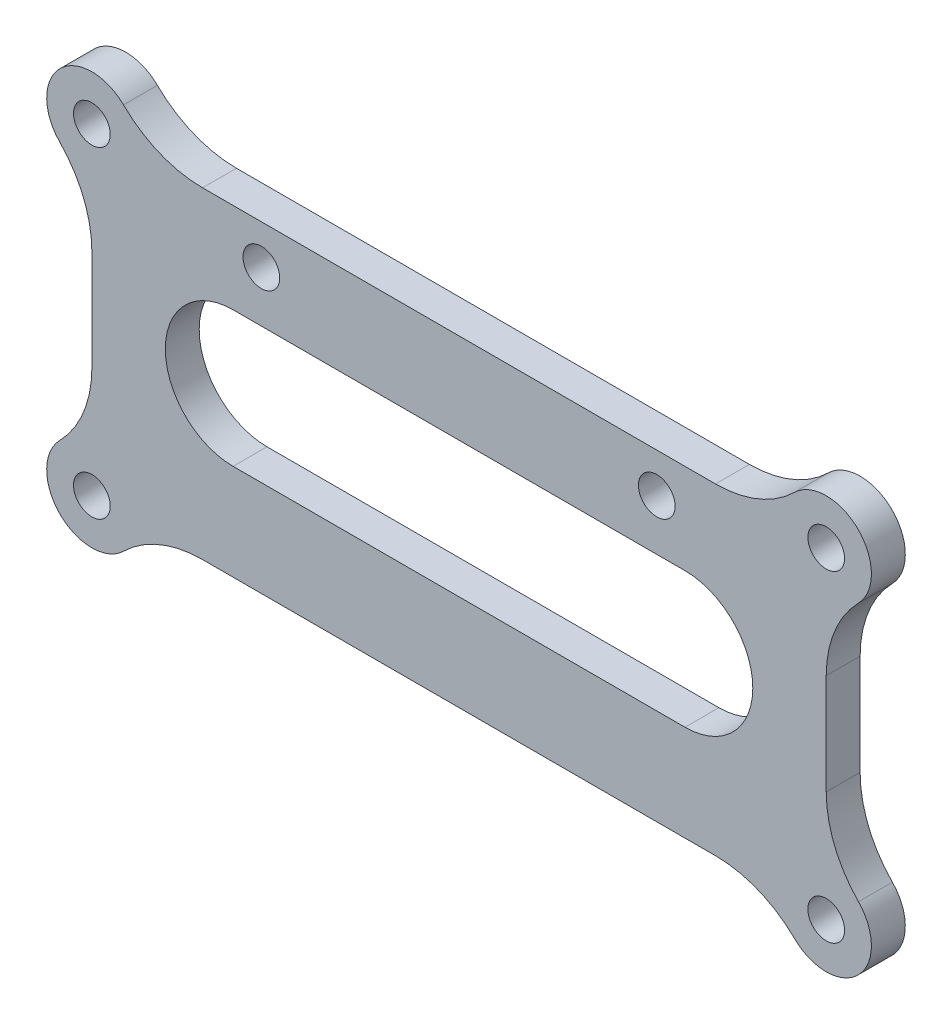
from build123d import *

# Parameters (mm, degrees)
SKETCH_1_R          = 1.625
EXTRUDE_1_DEPTH     = 3
FILLET_1_R          = 10
SKETCH_3_R          = 1.625
CUT_EXTRUDE_1_DEPTH = 10
CUT_EXTRUDE_4_DEPTH = 10


with BuildPart() as part:
    # Эскиз1 → Бобышка-Вытянуть1 (new body)
    with BuildSketch(Plane.XY):
        with BuildLine():
            ThreePointArc((-32.5, 4), (-35.328427125, -2.828427125), (-28.5, 0))
            Line((-28.5, 0), (28.5, 0))
            ThreePointArc((28.5, 0), (35.328427125, -2.828427125), (32.5, 4))
            Line((32.5, 4), (32.5, 24.5))
            ThreePointArc((32.5, 24.5), (35.328427125, 31.328427125), (28.5, 28.5))
            Line((28.5, 28.5), (-28.5, 28.5))
            ThreePointArc((-28.5, 28.5), (-35.328427125, 31.328427125), (-32.5, 24.5))
            Line((-32.5, 24.5), (-32.5, 4))
        make_face()
        with Locations((-32.5, 0)):
            Circle(SKETCH_1_R, mode=Mode.SUBTRACT)
        with Locations((32.5, 28.5)):
            Circle(SKETCH_1_R, mode=Mode.SUBTRACT)
        with Locations((-32.5, 28.5)):
            Circle(SKETCH_1_R, mode=Mode.SUBTRACT)
        with Locations((32.5, 0)):
            Circle(SKETCH_1_R, mode=Mode.SUBTRACT)
    extrude(amount=EXTRUDE_1_DEPTH)

    # Скругление1
    fillet_1_edges = [part.edges().sort_by_distance(p)[0] for p in [
        (28.5, 0, 1.5),
        (-28.5, 0, 1.5),
        (-32.5, 4, 1.5),
        (-32.5, 24.5, 1.5),
        (-28.5, 28.5, 1.5),
        (28.5, 28.5, 1.5),
        (32.5, 24.5, 1.5),
        (32.5, 4, 1.5),
    ]]
    fillet(fillet_1_edges, radius=FILLET_1_R)

    # Эскиз3 → Вырез-Вытянуть1 (cut)
    with BuildSketch(Plane(origin=(0, 0, 0), x_dir=(-1, 0, 0), z_dir=(0, 0, -1))):
        with Locations((-17.5, 25)):
            Circle(SKETCH_3_R)
        with Locations(Location((17.5, 25, 0), (0, 0, 180))):
            Circle(SKETCH_3_R)
    extrude(amount=-CUT_EXTRUDE_1_DEPTH, mode=Mode.SUBTRACT)

    # Эскиз7 → Вырез-Вытянуть4 (cut)
    with BuildSketch(Plane.XY.offset(3)):
        with BuildLine():
            Line((-20, 20.5), (20, 20.5))
            ThreePointArc((20, 20.5), (26, 14.5), (20, 8.5))
            Line((20, 8.5), (-20, 8.5))
            ThreePointArc((-20, 8.5), (-26, 14.5), (-20, 20.5))
        make_face()
    extrude(amount=-CUT_EXTRUDE_4_DEPTH, mode=Mode.SUBTRACT)


solid = part.part
